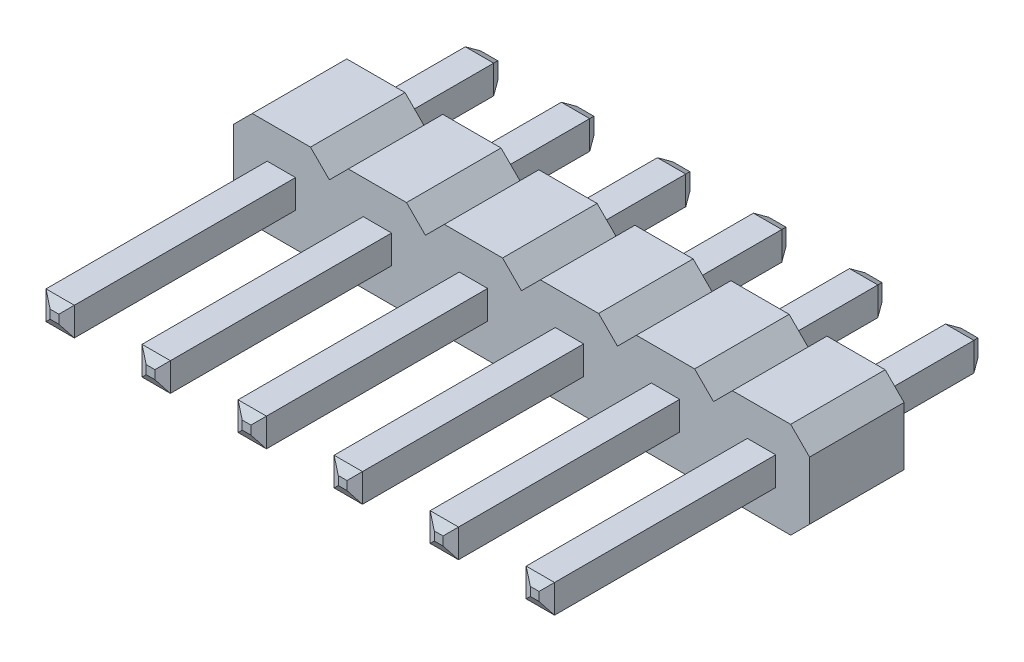
from build123d import *
from OCP.BRepFilletAPI import BRepFilletAPI_MakeChamfer

# Parameters (mm, degrees)
SKICA1_W                     = 0.75
SKICA1_H                     = 0.75
P_IDAT_VYSUNUT_M1_DEPTH      = 2.5
LINPOLE3_COUNT               = 6
LINPOLE3_PITCH               = 2.54
P_IDAT_VYSUNUT_M2_DEPTH      = 6
P_IDAT_VYSUNUT_M2_DEPTH_BACK = 5.5
SKICA2_W                     = 0.75
SKICA2_H                     = 0.75
ZKOSEN_2_SIZE                = 0.15
ZKOSEN_2_SIZE2               = 0.259807621


with BuildPart() as part:
    # Skica1 → Přidat vysunutím1 (new body)
    with BuildSketch(Plane.XY):
        Polygon((0.77, 1.27), (1.27, 0.77), (1.27, -0.77), (0.77, -1.27), (-0.77, -1.27), (-1.27, -0.77), (-1.27, 0.77), (-0.77, 1.27), align=None)
        Rectangle(SKICA1_W, SKICA1_H, mode=Mode.SUBTRACT)
    p_idat_vysunut_m1 = extrude(amount=P_IDAT_VYSUNUT_M1_DEPTH)

    # LinPole3: Přidat vysunutím1 ×6
    with Locations(*[(-i * LINPOLE3_PITCH, 0, 0) for i in range(1, LINPOLE3_COUNT)]):
        add(p_idat_vysunut_m1)

    # Skica2 → Přidat vysunutím2 (add, two sides: drawn at the far end of the back side and taken through both)
    with BuildSketch(Plane.XY.offset(2.5).offset(-P_IDAT_VYSUNUT_M2_DEPTH_BACK)):
        with Locations((-12.7, 0)):
            Rectangle(SKICA2_W, SKICA2_H)
        with Locations((-10.16, 0)):
            Rectangle(SKICA2_W, SKICA2_H)
        with Locations((-7.62, 0)):
            Rectangle(SKICA2_W, SKICA2_H)
        with Locations((-5.08, 0)):
            Rectangle(SKICA2_W, SKICA2_H)
        with Locations((-2.54, 0)):
            Rectangle(SKICA2_W, SKICA2_H)
        Rectangle(SKICA2_W, SKICA2_H)
    extrude(amount=P_IDAT_VYSUNUT_M2_DEPTH + P_IDAT_VYSUNUT_M2_DEPTH_BACK)

    # Zkosení2: one chamfer whose edges measure the first distance from different faces: ONE call of the kernel's chamfer builder (chamfer() names one face for all edges)
    zkosen_2_edges_1 = [part.edges().sort_by_distance(p)[0] for p in [
        (0, 0.375, -3),
        (0.375, 0, -3),
        (0, -0.375, -3),
        (-0.375, 0, -3),
    ]]
    zkosen_2_side_1 = [part.faces().sort_by_distance(p)[0] for p in [
        (0, 0, -3),
    ]]
    zkosen_2_edges_2 = [part.edges().sort_by_distance(p)[0] for p in [
        (0, 0.375, 8.5),
    ]]
    zkosen_2_side_2 = [part.faces().sort_by_distance(p)[0] for p in [
        (0, 0.375, 5.5),
    ]]
    zkosen_2_edges_3 = [part.edges().sort_by_distance(p)[0] for p in [
        (-0.375, 0, 8.5),
    ]]
    zkosen_2_side_3 = [part.faces().sort_by_distance(p)[0] for p in [
        (-0.375, 0, 5.5),
    ]]
    zkosen_2_edges_4 = [part.edges().sort_by_distance(p)[0] for p in [
        (0, -0.375, 8.5),
    ]]
    zkosen_2_side_4 = [part.faces().sort_by_distance(p)[0] for p in [
        (0, -0.375, 5.5),
    ]]
    zkosen_2_edges_5 = [part.edges().sort_by_distance(p)[0] for p in [
        (0.375, 0, 8.5),
    ]]
    zkosen_2_side_5 = [part.faces().sort_by_distance(p)[0] for p in [
        (0.375, 0, 5.5),
    ]]
    zkosen_2_edges_6 = [part.edges().sort_by_distance(p)[0] for p in [
        (-2.54, 0.375, -3),
        (-2.165, 0, -3),
        (-2.54, -0.375, -3),
        (-2.915, 0, -3),
    ]]
    zkosen_2_side_6 = [part.faces().sort_by_distance(p)[0] for p in [
        (-2.54, 0, -3),
    ]]
    zkosen_2_edges_7 = [part.edges().sort_by_distance(p)[0] for p in [
        (-2.54, 0.375, 8.5),
    ]]
    zkosen_2_side_7 = [part.faces().sort_by_distance(p)[0] for p in [
        (-2.54, 0.375, 5.5),
    ]]
    zkosen_2_edges_8 = [part.edges().sort_by_distance(p)[0] for p in [
        (-2.915, 0, 8.5),
    ]]
    zkosen_2_side_8 = [part.faces().sort_by_distance(p)[0] for p in [
        (-2.915, 0, 5.5),
    ]]
    zkosen_2_edges_9 = [part.edges().sort_by_distance(p)[0] for p in [
        (-2.54, -0.375, 8.5),
    ]]
    zkosen_2_side_9 = [part.faces().sort_by_distance(p)[0] for p in [
        (-2.54, -0.375, 5.5),
    ]]
    zkosen_2_edges_10 = [part.edges().sort_by_distance(p)[0] for p in [
        (-2.165, 0, 8.5),
    ]]
    zkosen_2_side_10 = [part.faces().sort_by_distance(p)[0] for p in [
        (-2.165, 0, 5.5),
    ]]
    zkosen_2_edges_11 = [part.edges().sort_by_distance(p)[0] for p in [
        (-5.08, 0.375, -3),
        (-4.705, 0, -3),
        (-5.08, -0.375, -3),
        (-5.455, 0, -3),
    ]]
    zkosen_2_side_11 = [part.faces().sort_by_distance(p)[0] for p in [
        (-5.08, 0, -3),
    ]]
    zkosen_2_edges_12 = [part.edges().sort_by_distance(p)[0] for p in [
        (-5.08, 0.375, 8.5),
    ]]
    zkosen_2_side_12 = [part.faces().sort_by_distance(p)[0] for p in [
        (-5.08, 0.375, 5.5),
    ]]
    zkosen_2_edges_13 = [part.edges().sort_by_distance(p)[0] for p in [
        (-5.455, 0, 8.5),
    ]]
    zkosen_2_side_13 = [part.faces().sort_by_distance(p)[0] for p in [
        (-5.455, 0, 5.5),
    ]]
    zkosen_2_edges_14 = [part.edges().sort_by_distance(p)[0] for p in [
        (-5.08, -0.375, 8.5),
    ]]
    zkosen_2_side_14 = [part.faces().sort_by_distance(p)[0] for p in [
        (-5.08, -0.375, 5.5),
    ]]
    zkosen_2_edges_15 = [part.edges().sort_by_distance(p)[0] for p in [
        (-4.705, 0, 8.5),
    ]]
    zkosen_2_side_15 = [part.faces().sort_by_distance(p)[0] for p in [
        (-4.705, 0, 5.5),
    ]]
    zkosen_2_edges_16 = [part.edges().sort_by_distance(p)[0] for p in [
        (-7.62, 0.375, -3),
        (-7.245, 0, -3),
        (-7.62, -0.375, -3),
        (-7.995, 0, -3),
    ]]
    zkosen_2_side_16 = [part.faces().sort_by_distance(p)[0] for p in [
        (-7.62, 0, -3),
    ]]
    zkosen_2_edges_17 = [part.edges().sort_by_distance(p)[0] for p in [
        (-7.62, 0.375, 8.5),
    ]]
    zkosen_2_side_17 = [part.faces().sort_by_distance(p)[0] for p in [
        (-7.62, 0.375, 5.5),
    ]]
    zkosen_2_edges_18 = [part.edges().sort_by_distance(p)[0] for p in [
        (-7.995, 0, 8.5),
    ]]
    zkosen_2_side_18 = [part.faces().sort_by_distance(p)[0] for p in [
        (-7.995, 0, 5.5),
    ]]
    zkosen_2_edges_19 = [part.edges().sort_by_distance(p)[0] for p in [
        (-7.62, -0.375, 8.5),
    ]]
    zkosen_2_side_19 = [part.faces().sort_by_distance(p)[0] for p in [
        (-7.62, -0.375, 5.5),
    ]]
    zkosen_2_edges_20 = [part.edges().sort_by_distance(p)[0] for p in [
        (-7.245, 0, 8.5),
    ]]
    zkosen_2_side_20 = [part.faces().sort_by_distance(p)[0] for p in [
        (-7.245, 0, 5.5),
    ]]
    zkosen_2_edges_21 = [part.edges().sort_by_distance(p)[0] for p in [
        (-10.16, 0.375, -3),
        (-9.785, 0, -3),
        (-10.16, -0.375, -3),
        (-10.535, 0, -3),
    ]]
    zkosen_2_side_21 = [part.faces().sort_by_distance(p)[0] for p in [
        (-10.16, 0, -3),
    ]]
    zkosen_2_edges_22 = [part.edges().sort_by_distance(p)[0] for p in [
        (-10.16, 0.375, 8.5),
    ]]
    zkosen_2_side_22 = [part.faces().sort_by_distance(p)[0] for p in [
        (-10.16, 0.375, 5.5),
    ]]
    zkosen_2_edges_23 = [part.edges().sort_by_distance(p)[0] for p in [
        (-10.535, 0, 8.5),
    ]]
    zkosen_2_side_23 = [part.faces().sort_by_distance(p)[0] for p in [
        (-10.535, 0, 5.5),
    ]]
    zkosen_2_edges_24 = [part.edges().sort_by_distance(p)[0] for p in [
        (-10.16, -0.375, 8.5),
    ]]
    zkosen_2_side_24 = [part.faces().sort_by_distance(p)[0] for p in [
        (-10.16, -0.375, 5.5),
    ]]
    zkosen_2_edges_25 = [part.edges().sort_by_distance(p)[0] for p in [
        (-9.785, 0, 8.5),
    ]]
    zkosen_2_side_25 = [part.faces().sort_by_distance(p)[0] for p in [
        (-9.785, 0, 5.5),
    ]]
    zkosen_2_edges_26 = [part.edges().sort_by_distance(p)[0] for p in [
        (-12.7, 0.375, -3),
        (-12.325, 0, -3),
        (-12.7, -0.375, -3),
        (-13.075, 0, -3),
    ]]
    zkosen_2_side_26 = [part.faces().sort_by_distance(p)[0] for p in [
        (-12.7, 0, -3),
    ]]
    zkosen_2_edges_27 = [part.edges().sort_by_distance(p)[0] for p in [
        (-12.7, 0.375, 8.5),
    ]]
    zkosen_2_side_27 = [part.faces().sort_by_distance(p)[0] for p in [
        (-12.7, 0.375, 5.5),
    ]]
    zkosen_2_edges_28 = [part.edges().sort_by_distance(p)[0] for p in [
        (-13.075, 0, 8.5),
    ]]
    zkosen_2_side_28 = [part.faces().sort_by_distance(p)[0] for p in [
        (-13.075, 0, 5.5),
    ]]
    zkosen_2_edges_29 = [part.edges().sort_by_distance(p)[0] for p in [
        (-12.7, -0.375, 8.5),
    ]]
    zkosen_2_side_29 = [part.faces().sort_by_distance(p)[0] for p in [
        (-12.7, -0.375, 5.5),
    ]]
    zkosen_2_edges_30 = [part.edges().sort_by_distance(p)[0] for p in [
        (-12.325, 0, 8.5),
    ]]
    zkosen_2_side_30 = [part.faces().sort_by_distance(p)[0] for p in [
        (-12.325, 0, 5.5),
    ]]
    zkosen_2 = BRepFilletAPI_MakeChamfer(part.part.solid().wrapped)
    for e in zkosen_2_edges_1:
        zkosen_2.Add(ZKOSEN_2_SIZE, ZKOSEN_2_SIZE2, e.wrapped, zkosen_2_side_1[0].wrapped)  # the first distance lies on this face
    for e in zkosen_2_edges_2:
        zkosen_2.Add(ZKOSEN_2_SIZE, ZKOSEN_2_SIZE2, e.wrapped, zkosen_2_side_2[0].wrapped)  # the first distance lies on this face
    for e in zkosen_2_edges_3:
        zkosen_2.Add(ZKOSEN_2_SIZE, ZKOSEN_2_SIZE2, e.wrapped, zkosen_2_side_3[0].wrapped)  # the first distance lies on this face
    for e in zkosen_2_edges_4:
        zkosen_2.Add(ZKOSEN_2_SIZE, ZKOSEN_2_SIZE2, e.wrapped, zkosen_2_side_4[0].wrapped)  # the first distance lies on this face
    for e in zkosen_2_edges_5:
        zkosen_2.Add(ZKOSEN_2_SIZE, ZKOSEN_2_SIZE2, e.wrapped, zkosen_2_side_5[0].wrapped)  # the first distance lies on this face
    for e in zkosen_2_edges_6:
        zkosen_2.Add(ZKOSEN_2_SIZE, ZKOSEN_2_SIZE2, e.wrapped, zkosen_2_side_6[0].wrapped)  # the first distance lies on this face
    for e in zkosen_2_edges_7:
        zkosen_2.Add(ZKOSEN_2_SIZE, ZKOSEN_2_SIZE2, e.wrapped, zkosen_2_side_7[0].wrapped)  # the first distance lies on this face
    for e in zkosen_2_edges_8:
        zkosen_2.Add(ZKOSEN_2_SIZE, ZKOSEN_2_SIZE2, e.wrapped, zkosen_2_side_8[0].wrapped)  # the first distance lies on this face
    for e in zkosen_2_edges_9:
        zkosen_2.Add(ZKOSEN_2_SIZE, ZKOSEN_2_SIZE2, e.wrapped, zkosen_2_side_9[0].wrapped)  # the first distance lies on this face
    for e in zkosen_2_edges_10:
        zkosen_2.Add(ZKOSEN_2_SIZE, ZKOSEN_2_SIZE2, e.wrapped, zkosen_2_side_10[0].wrapped)  # the first distance lies on this face
    for e in zkosen_2_edges_11:
        zkosen_2.Add(ZKOSEN_2_SIZE, ZKOSEN_2_SIZE2, e.wrapped, zkosen_2_side_11[0].wrapped)  # the first distance lies on this face
    for e in zkosen_2_edges_12:
        zkosen_2.Add(ZKOSEN_2_SIZE, ZKOSEN_2_SIZE2, e.wrapped, zkosen_2_side_12[0].wrapped)  # the first distance lies on this face
    for e in zkosen_2_edges_13:
        zkosen_2.Add(ZKOSEN_2_SIZE, ZKOSEN_2_SIZE2, e.wrapped, zkosen_2_side_13[0].wrapped)  # the first distance lies on this face
    for e in zkosen_2_edges_14:
        zkosen_2.Add(ZKOSEN_2_SIZE, ZKOSEN_2_SIZE2, e.wrapped, zkosen_2_side_14[0].wrapped)  # the first distance lies on this face
    for e in zkosen_2_edges_15:
        zkosen_2.Add(ZKOSEN_2_SIZE, ZKOSEN_2_SIZE2, e.wrapped, zkosen_2_side_15[0].wrapped)  # the first distance lies on this face
    for e in zkosen_2_edges_16:
        zkosen_2.Add(ZKOSEN_2_SIZE, ZKOSEN_2_SIZE2, e.wrapped, zkosen_2_side_16[0].wrapped)  # the first distance lies on this face
    for e in zkosen_2_edges_17:
        zkosen_2.Add(ZKOSEN_2_SIZE, ZKOSEN_2_SIZE2, e.wrapped, zkosen_2_side_17[0].wrapped)  # the first distance lies on this face
    for e in zkosen_2_edges_18:
        zkosen_2.Add(ZKOSEN_2_SIZE, ZKOSEN_2_SIZE2, e.wrapped, zkosen_2_side_18[0].wrapped)  # the first distance lies on this face
    for e in zkosen_2_edges_19:
        zkosen_2.Add(ZKOSEN_2_SIZE, ZKOSEN_2_SIZE2, e.wrapped, zkosen_2_side_19[0].wrapped)  # the first distance lies on this face
    for e in zkosen_2_edges_20:
        zkosen_2.Add(ZKOSEN_2_SIZE, ZKOSEN_2_SIZE2, e.wrapped, zkosen_2_side_20[0].wrapped)  # the first distance lies on this face
    for e in zkosen_2_edges_21:
        zkosen_2.Add(ZKOSEN_2_SIZE, ZKOSEN_2_SIZE2, e.wrapped, zkosen_2_side_21[0].wrapped)  # the first distance lies on this face
    for e in zkosen_2_edges_22:
        zkosen_2.Add(ZKOSEN_2_SIZE, ZKOSEN_2_SIZE2, e.wrapped, zkosen_2_side_22[0].wrapped)  # the first distance lies on this face
    for e in zkosen_2_edges_23:
        zkosen_2.Add(ZKOSEN_2_SIZE, ZKOSEN_2_SIZE2, e.wrapped, zkosen_2_side_23[0].wrapped)  # the first distance lies on this face
    for e in zkosen_2_edges_24:
        zkosen_2.Add(ZKOSEN_2_SIZE, ZKOSEN_2_SIZE2, e.wrapped, zkosen_2_side_24[0].wrapped)  # the first distance lies on this face
    for e in zkosen_2_edges_25:
        zkosen_2.Add(ZKOSEN_2_SIZE, ZKOSEN_2_SIZE2, e.wrapped, zkosen_2_side_25[0].wrapped)  # the first distance lies on this face
    for e in zkosen_2_edges_26:
        zkosen_2.Add(ZKOSEN_2_SIZE, ZKOSEN_2_SIZE2, e.wrapped, zkosen_2_side_26[0].wrapped)  # the first distance lies on this face
    for e in zkosen_2_edges_27:
        zkosen_2.Add(ZKOSEN_2_SIZE, ZKOSEN_2_SIZE2, e.wrapped, zkosen_2_side_27[0].wrapped)  # the first distance lies on this face
    for e in zkosen_2_edges_28:
        zkosen_2.Add(ZKOSEN_2_SIZE, ZKOSEN_2_SIZE2, e.wrapped, zkosen_2_side_28[0].wrapped)  # the first distance lies on this face
    for e in zkosen_2_edges_29:
        zkosen_2.Add(ZKOSEN_2_SIZE, ZKOSEN_2_SIZE2, e.wrapped, zkosen_2_side_29[0].wrapped)  # the first distance lies on this face
    for e in zkosen_2_edges_30:
        zkosen_2.Add(ZKOSEN_2_SIZE, ZKOSEN_2_SIZE2, e.wrapped, zkosen_2_side_30[0].wrapped)  # the first distance lies on this face
    add(Compound.cast(zkosen_2.Shape()), mode=Mode.REPLACE)


solid = part.part
